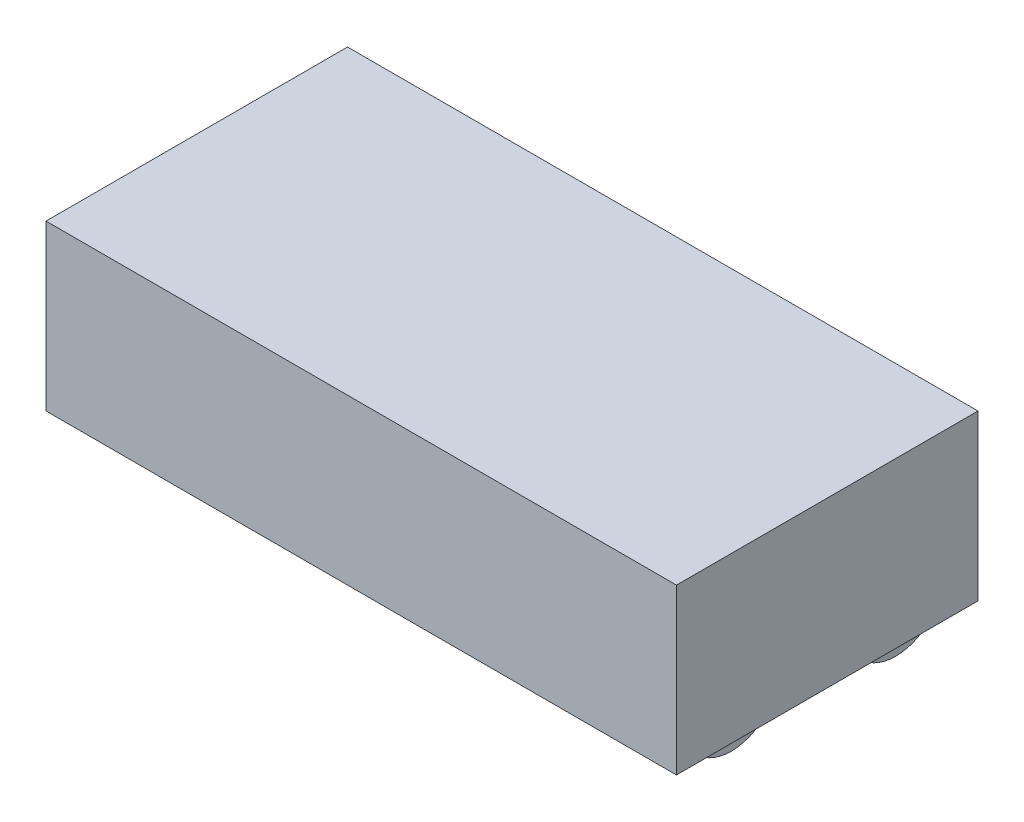
from build123d import *

# Parameters (mm, degrees)
CHASIS_W                = 584.2
CHASIS_H                = 279.4
BOSS_EXTRUDE1_DEPTH     = 152.4
SKETCH3_W               = 44.45
SKETCH3_H               = 44.45
MIRROR2_COPY_1_SKETCH_W = 44.45
MIRROR2_COPY_1_SKETCH_H = 44.45


with BuildPart() as part:
    # Chasis → Boss-Extrude1 (new body)
    with BuildSketch(Plane(origin=(0, 0, 0), x_dir=(1, 0, 0), z_dir=(0, 1, 0))):
        Rectangle(CHASIS_W, CHASIS_H)
    extrude(amount=BOSS_EXTRUDE1_DEPTH)

    # Sketch3 → Revolve1 (revolve)
    with BuildSketch(Plane(origin=(0, 25.4, 0), x_dir=(-1, 0, 0), z_dir=(0, -1, 0))):
        with Locations((257.175, -98.425)):
            Rectangle(SKETCH3_W, SKETCH3_H)
    revolve1 = revolve(axis=Axis((-279.4, 25.4, 76.2), (1, 0, 0)))

    # Mirror1: Revolve1 across plane
    add(revolve1.mirror(Plane.XY))

    # Mirror2: Revolve1 across plane
    add(revolve1.mirror(Plane(origin=(0, 0, 0), x_dir=(0, 0, 1), z_dir=(1, 0, 0))))

    # Mirror2 copy 1 sketch → Mirror2 copy 1 (revolve)
    with BuildSketch(Plane.XZ.offset(-25.4)):
        with Locations((257.175, -98.425)):
            Rectangle(MIRROR2_COPY_1_SKETCH_W, MIRROR2_COPY_1_SKETCH_H)
    revolve(axis=Axis((279.4, 25.4, -76.2), (-1, 0, 0)))


solid = part.part
